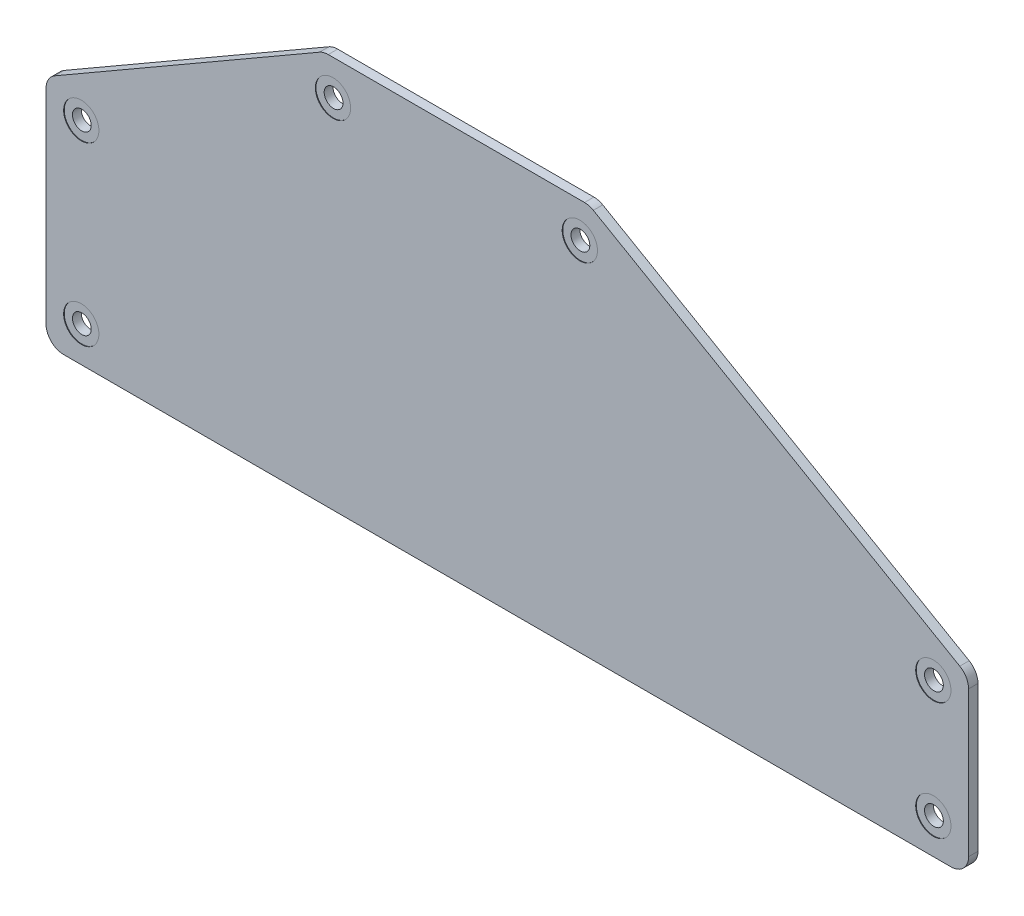
from build123d import *

# Parameters (mm, degrees)
SKETCH1_R           = 1.6
BOSS_EXTRUDE1_DEPTH = 1.6
FILLET1_R           = 3
SKETCH2_R           = 3
CUT_EXTRUDE1_DEPTH  = 0.1


with BuildPart() as part:
    # Sketch1 → Boss-Extrude1 (new body)
    with BuildSketch(Plane.XY):
        Polygon((0, 0), (157, 0), (157, 29.464101615), (92.447441117, 66.733538863), (47.232050808, 66.733538863), (0, 39.464101615), align=None)
        with Locations((6, 36)):
            Circle(SKETCH1_R, mode=Mode.SUBTRACT)
        with Locations((6, 6)):
            Circle(SKETCH1_R, mode=Mode.SUBTRACT)
        with Locations((151, 6)):
            Circle(SKETCH1_R, mode=Mode.SUBTRACT)
        with Locations((151, 26)):
            Circle(SKETCH1_R, mode=Mode.SUBTRACT)
        with Locations((90.839745962, 60.733538863)):
            Circle(SKETCH1_R, mode=Mode.SUBTRACT)
        with Locations((48.839745962, 60.733538863)):
            Circle(SKETCH1_R, mode=Mode.SUBTRACT)
    extrude(amount=BOSS_EXTRUDE1_DEPTH)

    # Fillet1
    fillet1_edges = [part.edges().sort_by_distance(p)[0] for p in [
        (0, 39.464101615, 0.8),
        (47.232050808, 66.733538863, 0.8),
        (92.447441117, 66.733538863, 0.8),
        (157, 29.464101615, 0.8),
        (157, 0, 0.8),
        (0, 0, 0.8),
    ]]
    fillet(fillet1_edges, radius=FILLET1_R)

    # Sketch2 → Cut-Extrude1 (cut)
    with BuildSketch(Plane.XY.offset(1.6)):
        with Locations((6, 6)):
            Circle(SKETCH2_R)
        with Locations((6, 36)):
            Circle(SKETCH2_R)
        with Locations((48.839745962, 60.733538863)):
            Circle(SKETCH2_R)
        with Locations((90.839745962, 60.733538863)):
            Circle(SKETCH2_R)
        with Locations((151, 26)):
            Circle(SKETCH2_R)
        with Locations((151, 6)):
            Circle(SKETCH2_R)
    extrude(amount=-CUT_EXTRUDE1_DEPTH, mode=Mode.SUBTRACT)


solid = part.part
